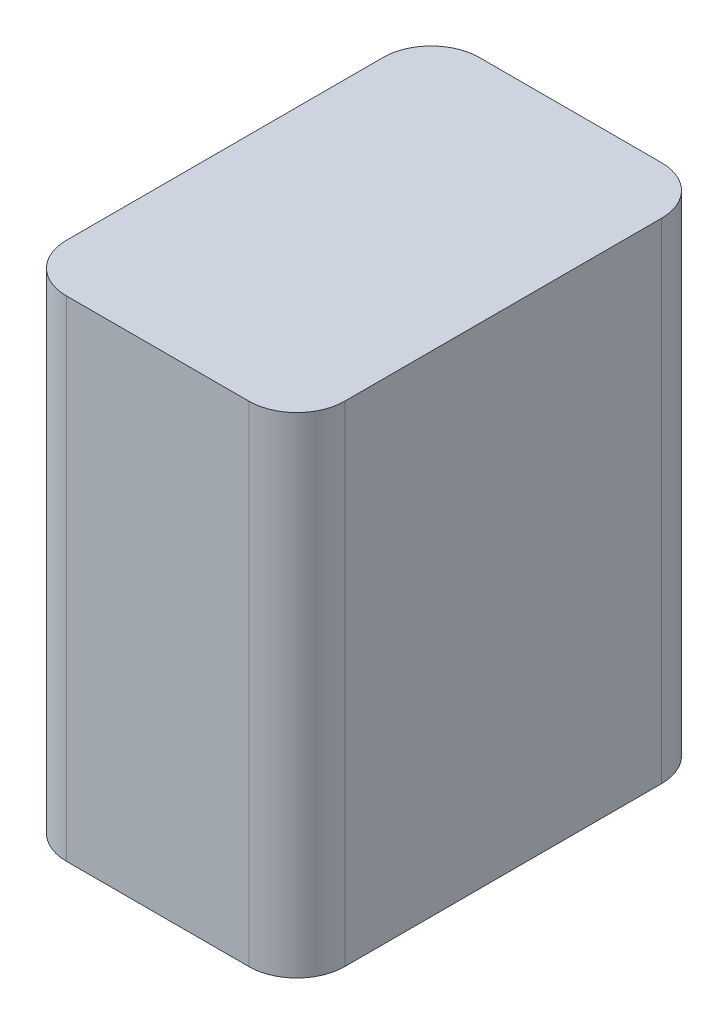
from build123d import *

# Parameters (mm, degrees)
SKETCH1_W           = 29
SKETCH1_H           = 43
BOSS_EXTRUDE1_DEPTH = 51
FILLET1_R           = 5


with BuildPart() as part:
    # Sketch1 → Boss-Extrude1 (new body)
    with BuildSketch(Plane(origin=(0, 0, 0), x_dir=(1, 0, 0), z_dir=(0, 1, 0))):
        with Locations((14.5, 21.5)):
            Rectangle(SKETCH1_W, SKETCH1_H)
    extrude(amount=BOSS_EXTRUDE1_DEPTH)

    # Fillet1
    fillet1_edges = [part.edges().sort_by_distance(p)[0] for p in [
        (0, 25.5, -43),
        (29, 25.5, -43),
        (29, 25.5, 0),
        (0, 25.5, 0),
    ]]
    fillet(fillet1_edges, radius=FILLET1_R)


solid = part.part
